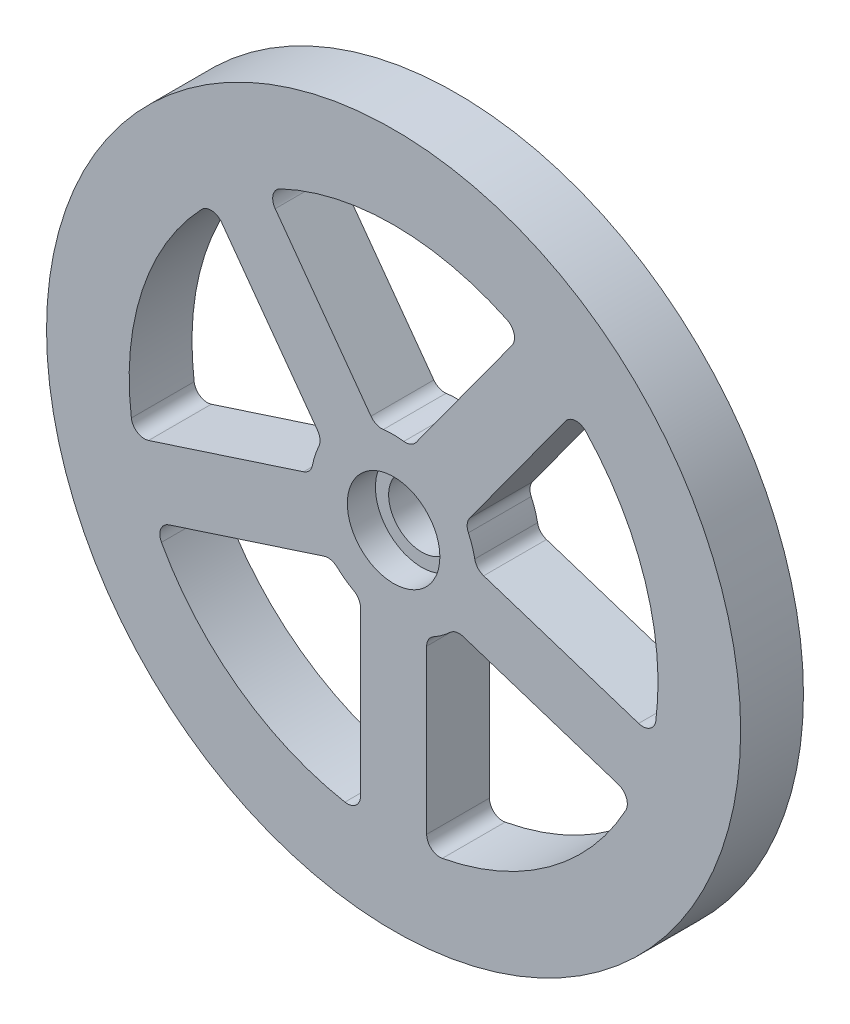
from build123d import *

# Parameters (mm, degrees)
ESQUISSE1_R                  = 105
BOSS_EXTRU_1_DEPTH           = 38
ENL_V_MAT_EXTRU_1_DEPTH      = 154.277526076
ENL_V_MAT_EXTRU_1_DEPTH_BACK = 154.277526076
ENL_V_MAT_EXTRU_2_DEPTH      = 154.277526076
ENL_V_MAT_EXTRU_2_DEPTH_BACK = 154.277526076
ESQUISSE3_R                  = 10
ESQUISSE4_R                  = 14
ENL_V_MAT_EXTRU_3_DEPTH      = 8.5
ENL_V_START                  = -29.5
ESQUISSE4_2_R                = 14
ENL_V_MAT_EXTRU_4_DEPTH      = 8.5
CONG_1_R                     = 4
ESQUISSE5_R                  = 105
ENL_V_MAT_EXTRU_5_DEPTH      = 19


with BuildPart() as part:
    # Esquisse1 → Boss.-Extru.1 (new body)
    with BuildSketch(Plane.XY):
        Circle(ESQUISSE1_R)
    extrude(amount=BOSS_EXTRU_1_DEPTH)

    # Esquisse2 → Enlèv. mat.-Extru.1 (cut, two sides: drawn at the far end of the back side and taken through both)
    with BuildSketch(Plane.XY.offset(38).offset(-ENL_V_MAT_EXTRU_1_DEPTH_BACK)):
        with BuildLine():
            Line((5.377682111, 24.414760599), (38.563838113, 70.091585729))
            ThreePointArc((38.563838113, 70.091585729), (0, 80), (-38.563838113, 70.091585729))
            Line((-38.563838113, 70.091585729), (-5.377682111, 24.414760599))
            ThreePointArc((-5.377682111, 24.414760599), (0, 25), (5.377682111, 24.414760599))
        make_face()
        with BuildLine():
            Line((24.881612324, 2.430096324), (78.57794069, -15.016898377))
            ThreePointArc((78.57794069, -15.016898377), (76.084521304, 24.72135955), (54.744178, 58.335880683))
            Line((54.744178, 58.335880683), (21.558021999, 12.659055553))
            ThreePointArc((21.558021999, 12.659055553), (23.776412907, 7.725424859), (24.881612324, 2.430096324))
        make_face()
        with BuildLine():
            Line((10, -22.912878475), (10, -79.372539332))
            ThreePointArc((10, -79.372539332), (47.022820183, -64.72135955), (72.397600803, -34.038028703))
            Line((72.397600803, -34.038028703), (18.701272437, -16.591034002))
            ThreePointArc((18.701272437, -16.591034002), (14.694631307, -20.225424859), (10, -22.912878475))
        make_face()
        with BuildLine():
            Line((-18.701272437, -16.591034002), (-72.397600803, -34.038028703))
            ThreePointArc((-72.397600803, -34.038028703), (-47.022820183, -64.72135955), (-10, -79.372539332))
            Line((-10, -79.372539332), (-10, -22.912878475))
            ThreePointArc((-10, -22.912878475), (-14.694631307, -20.225424859), (-18.701272437, -16.591034002))
        make_face()
        with BuildLine():
            Line((-21.558021999, 12.659055553), (-54.744178, 58.335880683))
            ThreePointArc((-54.744178, 58.335880683), (-76.084521304, 24.72135955), (-78.57794069, -15.016898377))
            Line((-78.57794069, -15.016898377), (-24.881612324, 2.430096324))
            ThreePointArc((-24.881612324, 2.430096324), (-23.776412907, 7.725424859), (-21.558021999, 12.659055553))
        make_face()
    extrude(amount=ENL_V_MAT_EXTRU_1_DEPTH + ENL_V_MAT_EXTRU_1_DEPTH_BACK, mode=Mode.SUBTRACT)

    # Esquisse3 → Enlèv. mat.-Extru.2 (cut, two sides: drawn at the far end of the back side and taken through both)
    with BuildSketch(Plane.XY.offset(38).offset(-ENL_V_MAT_EXTRU_2_DEPTH_BACK)):
        Circle(ESQUISSE3_R)
    extrude(amount=ENL_V_MAT_EXTRU_2_DEPTH + ENL_V_MAT_EXTRU_2_DEPTH_BACK, mode=Mode.SUBTRACT)

    # Esquisse4 → Enlèv. mat.-Extru.3 (cut)
    with BuildSketch(Plane.XY.offset(38)):
        Circle(ESQUISSE4_R)
    extrude(amount=-ENL_V_MAT_EXTRU_3_DEPTH, mode=Mode.SUBTRACT)

    # Esquisse4<2> → Enlèv. mat.-Extru.4 (cut)
    with BuildSketch(Plane.XY.offset(38).offset(ENL_V_START)):
        Circle(ESQUISSE4_2_R)
    extrude(amount=-ENL_V_MAT_EXTRU_4_DEPTH, mode=Mode.SUBTRACT)

    # Congé1
    cong_1_edges = [part.edges().sort_by_distance(p)[0] for p in [
        (-78.57794069, -15.016898377, 19),
        (-54.744178, 58.335880683, 19),
        (-21.558021999, 12.659055553, 19),
        (-24.881612324, 2.430096324, 19),
        (-10, -79.372539332, 19),
        (-72.397600803, -34.038028703, 19),
        (-18.701272437, -16.591034002, 19),
        (-10, -22.912878475, 19),
        (72.397600803, -34.038028703, 19),
        (10, -79.372539332, 19),
        (10, -22.912878475, 19),
        (18.701272437, -16.591034002, 19),
        (54.744178, 58.335880683, 19),
        (78.57794069, -15.016898377, 19),
        (24.881612324, 2.430096324, 19),
        (21.558021999, 12.659055553, 19),
        (-38.563838113, 70.091585729, 19),
        (38.563838113, 70.091585729, 19),
        (5.377682111, 24.414760599, 19),
        (-5.377682111, 24.414760599, 19),
    ]]
    fillet(cong_1_edges, radius=CONG_1_R)

    # Esquisse5 → Enlèv. mat.-Extru.5 (cut)
    with BuildSketch(Plane(origin=(0, 0, 0), x_dir=(-1, 0, 0), z_dir=(0, 0, -1))):
        Circle(ESQUISSE5_R)
    extrude(amount=-ENL_V_MAT_EXTRU_5_DEPTH, mode=Mode.SUBTRACT)


solid = part.part
